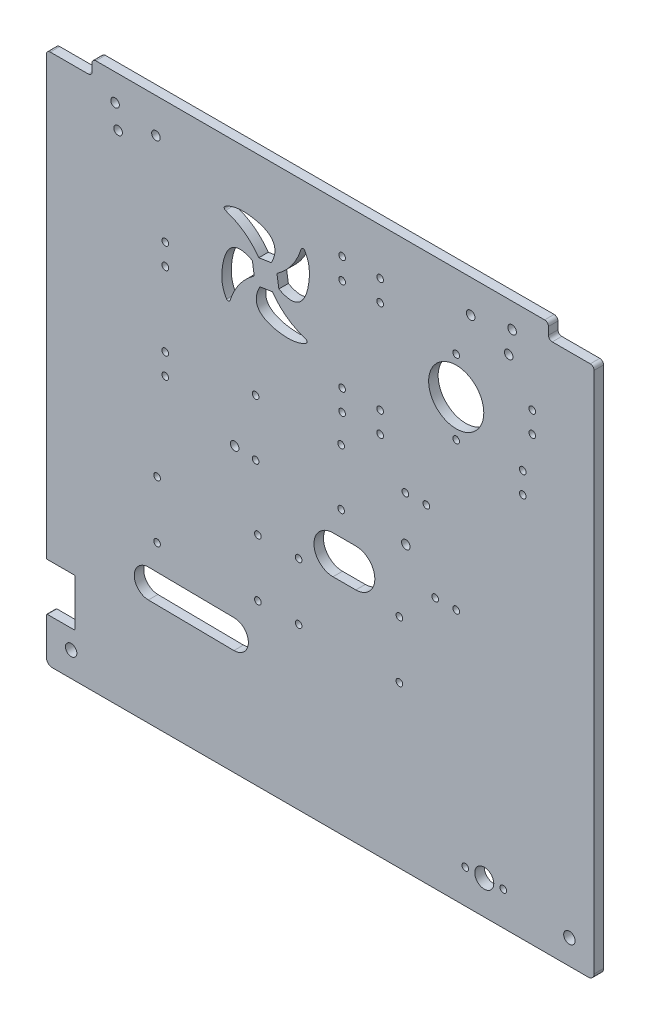
from build123d import *

# Parameters (mm, degrees)
SKETCH1_R           = 3
SKETCH1_R_2         = 2.25
SKETCH1_R_3         = 1.75
SKETCH1_R_4         = 14.5
SKETCH1_R_5         = 1.77
SKETCH1_R_6         = 1.8
SKETCH1_R_7         = 5
BOSS_EXTRUDE1_DEPTH = 5


with BuildPart() as part:
    # Sketch1 → Boss-Extrude1 (new body)
    with BuildSketch(Plane.XY):
        with BuildLine():
            Line((119, 137.85), (-117, 137.85))
            ThreePointArc((-117, 137.85), (-118.414213562, 137.264213563), (-119, 135.85))
            Line((-119, 135.85), (-119, 131.85))
            ThreePointArc((-119, 131.85), (-119.585786438, 130.435786438), (-121, 129.85))
            Line((-121, 129.85), (-141, 129.85))
            ThreePointArc((-141, 129.85), (-142.414213562, 129.264213563), (-143, 127.85))
            Line((-143, 127.85), (-143, -101.5))
            ThreePointArc((-143, -101.5), (-142.853553391, -101.853553391), (-142.5, -102))
            Line((-142.5, -102), (-128.5, -102))
            ThreePointArc((-128.5, -102), (-128.14644661, -102.146446609), (-128, -102.5))
            Line((-128, -102.5), (-128, -126.5))
            ThreePointArc((-128, -126.5), (-128.14644661, -126.853553391), (-128.5, -127))
            Line((-128.5, -127), (-142.5, -127))
            ThreePointArc((-142.5, -127), (-142.853553391, -127.146446609), (-143, -127.5))
            Line((-143, -127.5), (-143, -147))
            ThreePointArc((-143, -147), (-142.121320344, -149.121320344), (-140, -150))
            Line((-140, -150), (142, -150))
            ThreePointArc((142, -150), (144.121320344, -149.121320344), (145, -147))
            Line((145, -147), (145, 127.85))
            ThreePointArc((145, 127.85), (144.414213562, 129.264213563), (143, 129.85))
            Line((143, 129.85), (123, 129.85))
            ThreePointArc((123, 129.85), (121.585786438, 130.435786438), (121, 131.85))
            Line((121, 131.85), (121, 135.85))
            ThreePointArc((121, 135.85), (120.414213562, 137.264213563), (119, 137.85))
        make_face()
        with Locations((132, -137)):
            Circle(SKETCH1_R, mode=Mode.SUBTRACT)
        with Locations((-130, -136.98801067)):
            Circle(SKETCH1_R, mode=Mode.SUBTRACT)
        with Locations((80.1, 120.55)):
            Circle(SKETCH1_R_2, mode=Mode.SUBTRACT)
        with Locations((101.9, 124.85)):
            Circle(SKETCH1_R_2, mode=Mode.SUBTRACT)
        with Locations((100.1, 112.65)):
            Circle(SKETCH1_R_2, mode=Mode.SUBTRACT)
        with Locations((-85.403167437, 119.6)):
            Circle(SKETCH1_R_2, mode=Mode.SUBTRACT)
        with Locations((-105.303167437, 112)):
            Circle(SKETCH1_R_2, mode=Mode.SUBTRACT)
        with Locations((-106.903167437, 123.8)):
            Circle(SKETCH1_R_2, mode=Mode.SUBTRACT)
        with Locations((-84.791108936, -35.5)):
            Circle(SKETCH1_R_3, mode=Mode.SUBTRACT)
        with Locations((45.999972222, -0.949999618)):
            Circle(SKETCH1_R_2, mode=Mode.SUBTRACT)
        with Locations((-84.791108936, -65.5)):
            Circle(SKETCH1_R_3, mode=Mode.SUBTRACT)
        with Locations((-43.999972222, -1.050000381)):
            Circle(SKETCH1_R_2, mode=Mode.SUBTRACT)
        with Locations((72.5, 79.5)):
            Circle(SKETCH1_R_4, mode=Mode.SUBTRACT)
        with Locations((-31.791108936, -65.5)):
            Circle(SKETCH1_R_3, mode=Mode.SUBTRACT)
        with Locations((72.5, 60)):
            Circle(SKETCH1_R_3, mode=Mode.SUBTRACT)
        with Locations((72.5, 99)):
            Circle(SKETCH1_R_3, mode=Mode.SUBTRACT)
        with Locations((-10.373326807, -65.5)):
            Circle(SKETCH1_R_3, mode=Mode.SUBTRACT)
        with Locations((42.626673193, -65.5)):
            Circle(SKETCH1_R_3, mode=Mode.SUBTRACT)
        with Locations((42.626673193, -35.5)):
            Circle(SKETCH1_R_3, mode=Mode.SUBTRACT)
        with Locations((-31.791108936, -35.5)):
            Circle(SKETCH1_R_3, mode=Mode.SUBTRACT)
        with Locations((-10.373326807, -35.5)):
            Circle(SKETCH1_R_3, mode=Mode.SUBTRACT)
        with Locations((-33, 27.5)):
            Circle(SKETCH1_R_3, mode=Mode.SUBTRACT)
        with Locations((-33, -2)):
            Circle(SKETCH1_R_3, mode=Mode.SUBTRACT)
        with Locations((12, 27.5)):
            Circle(SKETCH1_R_3, mode=Mode.SUBTRACT)
        with Locations((12, -2)):
            Circle(SKETCH1_R_3, mode=Mode.SUBTRACT)
        with Locations((12.5, 113.5)):
            Circle(SKETCH1_R_3, mode=Mode.SUBTRACT)
        with Locations((12.5, 102.46)):
            Circle(SKETCH1_R_3, mode=Mode.SUBTRACT)
        with Locations((32.5, 113.5)):
            Circle(SKETCH1_R_3, mode=Mode.SUBTRACT)
        with Locations((32.5, 102.46)):
            Circle(SKETCH1_R_3, mode=Mode.SUBTRACT)
        with Locations((12.5, 53.54)):
            Circle(SKETCH1_R_3, mode=Mode.SUBTRACT)
        with Locations((32.5, 53.54)):
            Circle(SKETCH1_R_3, mode=Mode.SUBTRACT)
        with Locations((32.5, 42.5)):
            Circle(SKETCH1_R_5, mode=Mode.SUBTRACT)
        with Locations((12.5, 42.5)):
            Circle(SKETCH1_R_3, mode=Mode.SUBTRACT)
        with Locations((45.752852724, 22.5)):
            Circle(SKETCH1_R_3, mode=Mode.SUBTRACT)
        with Locations((56.792852724, 22.5)):
            Circle(SKETCH1_R_3, mode=Mode.SUBTRACT)
        with Locations((61.46, -17.5)):
            Circle(SKETCH1_R_3, mode=Mode.SUBTRACT)
        with Locations((72.5, -17.5)):
            Circle(SKETCH1_R_3, mode=Mode.SUBTRACT)
        with Locations((-80.5, 23.5)):
            Circle(SKETCH1_R_3, mode=Mode.SUBTRACT)
        with Locations((-80.5, 12.46)):
            Circle(SKETCH1_R_3, mode=Mode.SUBTRACT)
        with Locations((112.5, 93.54)):
            Circle(SKETCH1_R_3, mode=Mode.SUBTRACT)
        with Locations((112.5, 82.5)):
            Circle(SKETCH1_R_3, mode=Mode.SUBTRACT)
        with Locations((107.5, 63.5)):
            Circle(SKETCH1_R_3, mode=Mode.SUBTRACT)
        with Locations((107.5, 52.46)):
            Circle(SKETCH1_R_3, mode=Mode.SUBTRACT)
        with Locations((-80.5, 73.5)):
            Circle(SKETCH1_R_3, mode=Mode.SUBTRACT)
        with Locations((-80.5, 62.46)):
            Circle(SKETCH1_R_6, mode=Mode.SUBTRACT)
        with Locations((87.25, -132.25)):
            Circle(SKETCH1_R_7, mode=Mode.SUBTRACT)
        with Locations((77.25, -132.25)):
            Circle(SKETCH1_R_3, mode=Mode.SUBTRACT)
        with Locations((97.25, -132.25)):
            Circle(SKETCH1_R_3, mode=Mode.SUBTRACT)
        with BuildLine():
            Line((7.701292612, -14.765451744), (19.701292612, -14.765451744))
            ThreePointArc((19.701292612, -14.765451744), (29.701292612, -24.765451744), (19.701292612, -34.765451744))
            Line((19.701292612, -34.765451744), (7.701292612, -34.765451744))
            ThreePointArc((7.701292612, -34.765451744), (-2.298707388, -24.765451744), (7.701292612, -14.765451744))
        make_face(mode=Mode.SUBTRACT)
        with BuildLine():
            Line((-89.211061563, -78.889424509), (-44.211061563, -79.423092657))
            ThreePointArc((-44.211061563, -79.423092657), (-36.800527355, -87.01150374), (-44.388938437, -94.422037947))
            Line((-44.388938437, -94.422037947), (-89.388938437, -93.888369799))
            ThreePointArc((-89.388938437, -93.888369799), (-96.799472645, -86.299958717), (-89.211061563, -78.889424509))
        make_face(mode=Mode.SUBTRACT)
        with BuildLine():
            Line((-20.765442271, 82.042263173), (-21.760088994, 88.603452442))
            add(Edge.make_bspline(
                [(-21.760088994, 88.603452442), (-15.581917564, 92.98846813), (-11.286155824, 98.883660406), (-8.99377257, 106.126506389)],
                knots=[0, 0, 0, 0, 0.918480676, 0.918480676, 0.918480676, 0.918480676], degree=3))
            ThreePointArc((-8.99377257, 106.126506389), (-8.165849028, 106.816854641), (-7.192132058, 106.35434695))
            add(Edge.make_bspline(
                [(-7.192132058, 106.35434695), (-5.951098608, 104.366564333), (-4.534413043, 100.165736474), (-4.849455476, 88.003219654), (-9.488562584, 76.016189543), (-20.765442271, 82.042263173)],
                knots=[0.050637749, 0.050637749, 0.050637749, 0.050637749, 0.222928156, 0.39163585, 1, 1, 1, 1], degree=3))
        make_face(mode=Mode.SUBTRACT)
        with BuildLine():
            Line((-30.72614089, 78.073067173), (-24.164951621, 79.067713897))
            add(Edge.make_bspline(
                [(-24.164951621, 79.067713897), (-19.779935933, 72.889542467), (-13.884743657, 68.593780727), (-6.641897674, 66.301397473)],
                knots=[0, 0, 0, 0, 0.918480676, 0.918480676, 0.918480676, 0.918480676], degree=3))
            ThreePointArc((-6.641897674, 66.301397473), (-5.951549422, 65.47347393), (-6.414057113, 64.49975696))
            add(Edge.make_bspline(
                [(-6.414057113, 64.49975696), (-8.40183973, 63.25872351), (-12.602667589, 61.842037945), (-24.765184409, 62.157080378), (-36.75221452, 66.796187486), (-30.72614089, 78.073067173)],
                knots=[0.050637749, 0.050637749, 0.050637749, 0.050637749, 0.222928156, 0.39163585, 1, 1, 1, 1], degree=3))
        make_face(mode=Mode.SUBTRACT)
        with BuildLine():
            Line((-34.69533689, 88.033765792), (-33.700690166, 81.472576523))
            add(Edge.make_bspline(
                [(-33.700690166, 81.472576523), (-39.878861596, 77.087560835), (-44.174623336, 71.192368559), (-46.46700659, 63.949522577)],
                knots=[0, 0, 0, 0, 0.918480676, 0.918480676, 0.918480676, 0.918480676], degree=3))
            ThreePointArc((-46.46700659, 63.949522577), (-47.294930133, 63.259174324), (-48.268647103, 63.721682015))
            add(Edge.make_bspline(
                [(-48.268647103, 63.721682015), (-49.509680553, 65.709464633), (-50.926366118, 69.910292491), (-50.611323685, 82.072809312), (-45.972216577, 94.059839422), (-34.69533689, 88.033765792)],
                knots=[0.050637749, 0.050637749, 0.050637749, 0.050637749, 0.222928156, 0.39163585, 1, 1, 1, 1], degree=3))
        make_face(mode=Mode.SUBTRACT)
        with BuildLine():
            Line((-24.734638271, 92.002961792), (-31.29582754, 91.008315069))
            add(Edge.make_bspline(
                [(-31.29582754, 91.008315069), (-35.680843228, 97.186486499), (-41.576035504, 101.482248239), (-48.818881486, 103.774631493)],
                knots=[0, 0, 0, 0, 0.918480676, 0.918480676, 0.918480676, 0.918480676], degree=3))
            ThreePointArc((-48.818881486, 103.774631493), (-49.509229739, 104.602555035), (-49.046722048, 105.576272005))
            add(Edge.make_bspline(
                [(-49.046722048, 105.576272005), (-47.05893943, 106.817305455), (-42.858111572, 108.23399102), (-30.695594751, 107.918948587), (-18.708564641, 103.279841479), (-24.734638271, 92.002961792)],
                knots=[0.050637749, 0.050637749, 0.050637749, 0.050637749, 0.222928156, 0.39163585, 1, 1, 1, 1], degree=3))
        make_face(mode=Mode.SUBTRACT)
    extrude(amount=BOSS_EXTRUDE1_DEPTH)


solid = part.part
